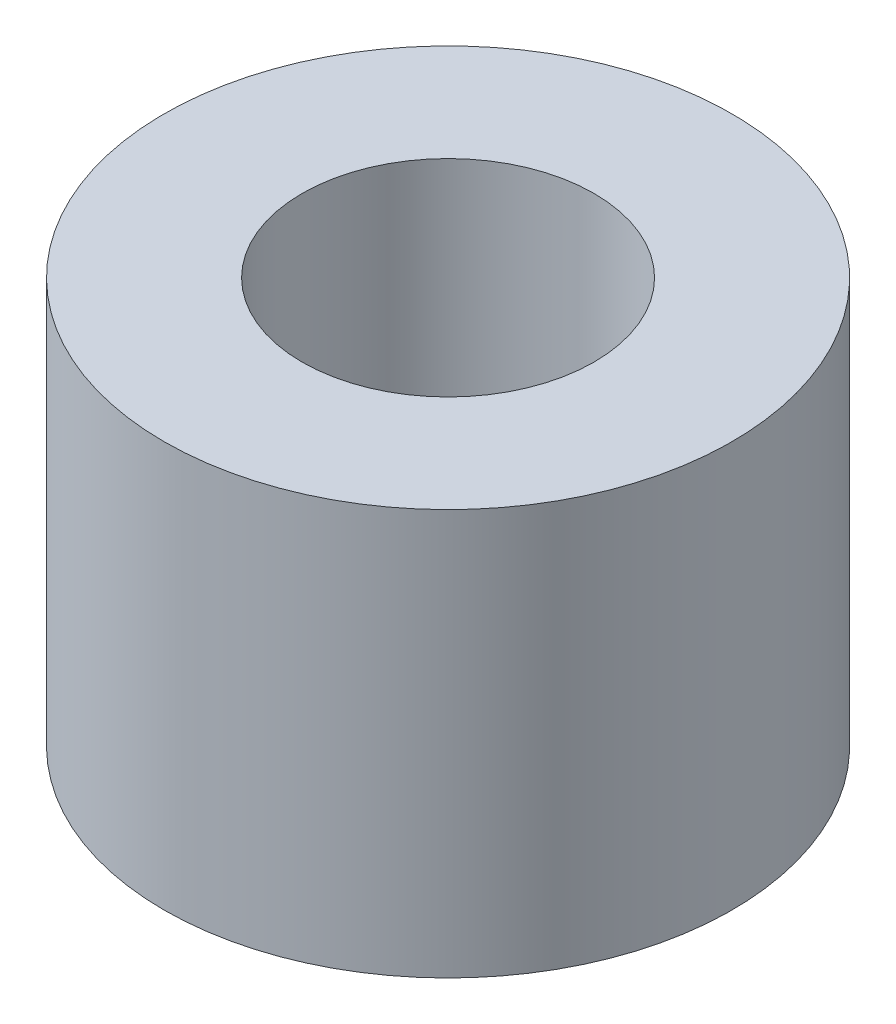
from build123d import *

# Parameters (mm, degrees)
SKETCH1_R           = 3.5
SKETCH1_R_2         = 1.8
BOSS_EXTRUDE1_DEPTH = 2.5


with BuildPart() as part:
    # Sketch1 → Boss-Extrude1 (new, symmetric)
    with BuildSketch(Plane(origin=(0, 0, 0), x_dir=(1, 0, 0), z_dir=(0, 1, 0))):
        with Locations(Location((0, 0, 0), (0, 0, 270))):
            Circle(SKETCH1_R)
        with Locations(Location((0, 0, 0), (0, 0, 270))):
            Circle(SKETCH1_R_2, mode=Mode.SUBTRACT)
    extrude(amount=BOSS_EXTRUDE1_DEPTH, both=True)


solid = part.part
